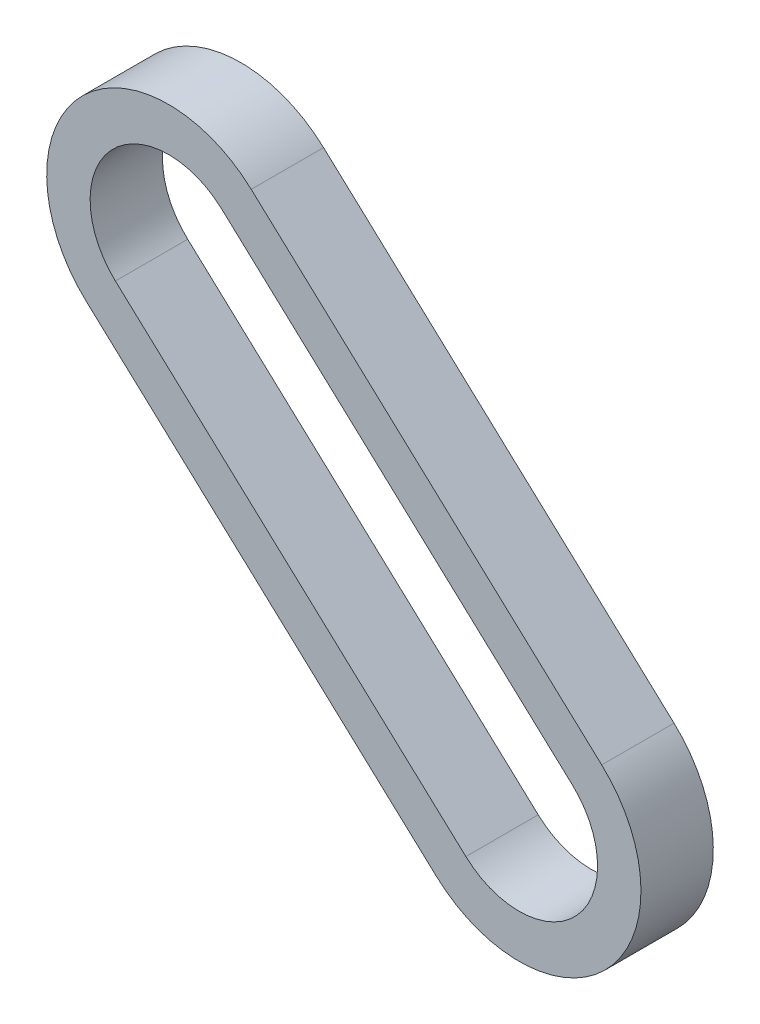
from build123d import *

# Parameters (mm, degrees)
EXTRUDE_THIN1_DEPTH = 10


with BuildPart() as part:
    # Sketch2 → Extrude-Thin1 (new body)
    with BuildSketch(Plane.XY):
        with BuildLine():
            Line((-29.545524043, 50.124146881), (18.910373448, 5.440319336))
            ThreePointArc((18.910373448, 5.440319336), (19.874654919, -18.369660951), (-3.935325368, -19.333942422))
            Line((-3.935325368, -19.333942422), (-52.391222859, 25.349885124))
            ThreePointArc((-52.391222859, 25.349885124), (-53.35550433, 49.15986541), (-29.545524043, 50.124146881))
        make_face()
        with BuildLine():
            Line((-33.613007512, 45.71329909), (14.842889979, 1.029471545))
            ThreePointArc((14.842889979, 1.029471545), (15.463807128, -14.302177482), (0.132158101, -14.923094631))
            Line((0.132158101, -14.923094631), (-48.32373939, 29.760732914))
            ThreePointArc((-48.32373939, 29.760732914), (-48.944656539, 45.092381941), (-33.613007512, 45.71329909))
        make_face(mode=Mode.SUBTRACT)
    extrude(amount=EXTRUDE_THIN1_DEPTH)


solid = part.part
